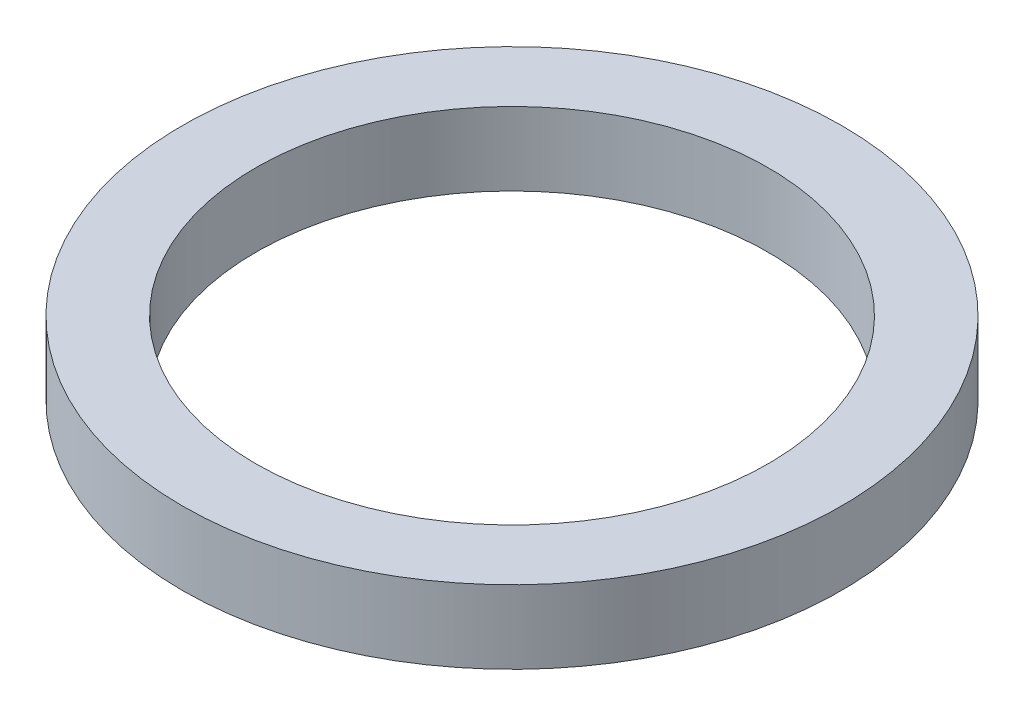
from build123d import *

# Parameters (mm, degrees)
SKETCH1_R           = 22.5
SKETCH1_R_2         = 17.5
BOSS_EXTRUDE1_DEPTH = 5


with BuildPart() as part:
    # Sketch1 → Boss-Extrude1 (new body)
    with BuildSketch(Plane(origin=(0, 0, 0), x_dir=(1, 0, 0), z_dir=(0, 1, 0))):
        with Locations(Location((0, 0, 0), (0, 0, 270))):
            Circle(SKETCH1_R)
        with Locations(Location((0, 0, 0), (0, 0, 270))):
            Circle(SKETCH1_R_2, mode=Mode.SUBTRACT)
    extrude(amount=BOSS_EXTRUDE1_DEPTH)


solid = part.part
